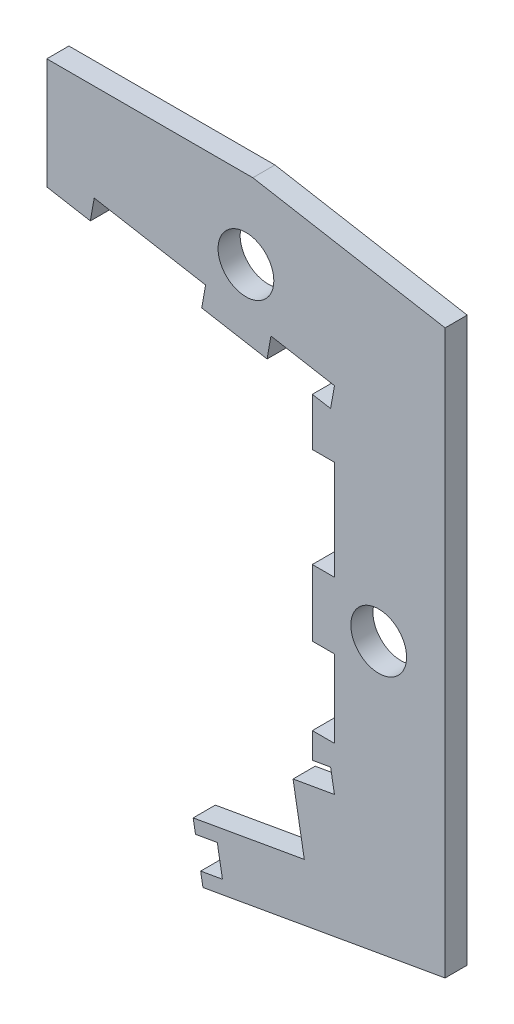
from build123d import *

# Parameters (mm, degrees)
ESQUISSE1_R             = 6.3
BOSS_EXTRU_1_DEPTH      = 5
ENL_V_MAT_EXTRU_1_DEPTH = 5
ESQUISSE3_W             = 5
ESQUISSE3_H             = 15
BOSS_EXTRU_3_DEPTH      = 5


with BuildPart() as part:
    # Esquisse1 → Boss.-Extru.1 (new body)
    with BuildSketch(Plane.XY):
        Polygon((-65, 51.461253746), (0, 40), (0, -40), (-9.359100785, -41.650261983), (-6.809077296, -56.112163836), (-31.918247866, -60.539588071), (-29.710027076, -73.063030491), (25, -63.416176602), (25, 63.800831685), (-18.444412366, 71.461253746), (-65, 71.461253746), align=None)
        with Locations((-20, 53.680805733)):
            Circle(ESQUISSE1_R, mode=Mode.SUBTRACT)
        with Locations(Location((10, -5, 0), (0, 0, 180))):
            Circle(ESQUISSE1_R, mode=Mode.SUBTRACT)
    extrude(amount=BOSS_EXTRU_1_DEPTH)

    # Esquisse2 → Enlèv. mat.-Extru.1 (cut)
    with BuildSketch(Plane(origin=(0, 0, 0), x_dir=(-1, 0, 0), z_dir=(0, 0, -1))):
        Polygon((31.396602506, -63.497985917), (30.230971609, -70.108607232), (25.306932844, -69.240366344), (26.472563741, -62.629745029), align=None)
    extrude(amount=-ENL_V_MAT_EXTRU_1_DEPTH, mode=Mode.SUBTRACT)

    # Esquisse3 → Boss.-Extru.3 (add)
    with BuildSketch(Plane.XY):
        Polygon((0, -40), (0, -30), (-5, -30), (-5, -35.804501844), (-0.868240888, -35.075961235), align=None)
        with Locations((-2.5, -5)):
            Rectangle(ESQUISSE3_W, ESQUISSE3_H)
        Polygon((-0.868240888, 35.075961235), (0, 40), (0, 25), (-5, 25), (-5, 35.804501844), align=None)
        Polygon((-29.122539924, 45.135089535), (-14.350423629, 42.53036687), (-15.218664517, 37.606328105), (-29.990780813, 40.21105077), align=None)
        Polygon((-65, 51.461253746), (-65, 46.384120687), (-55.15192247, 44.64763891), (-54.283681582, 49.571677675), align=None)
    extrude(amount=BOSS_EXTRU_3_DEPTH)


solid = part.part
